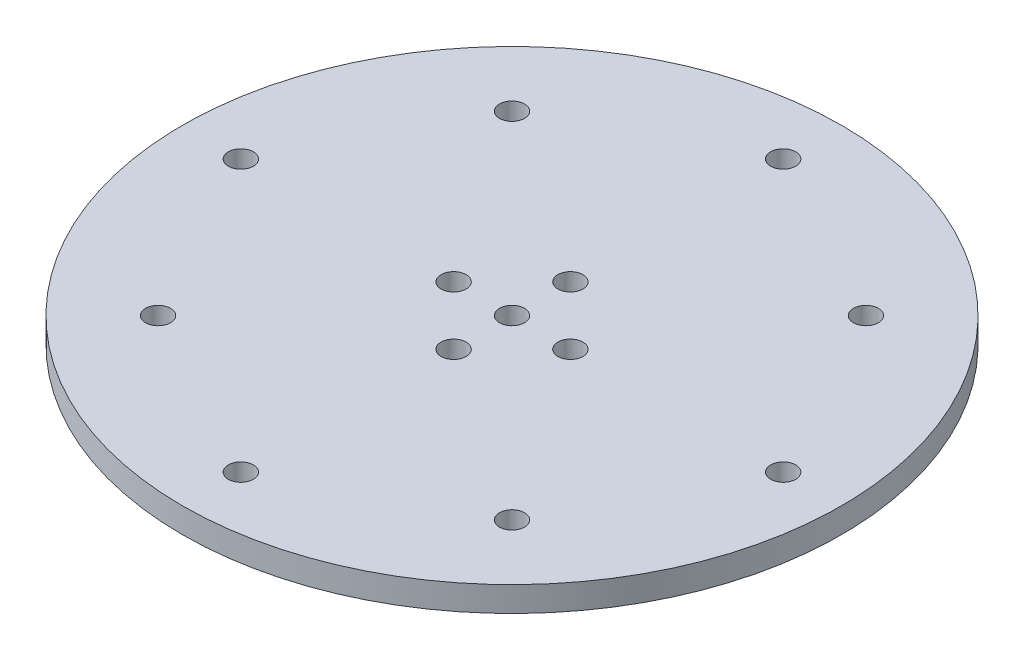
from build123d import *

# Parameters (mm, degrees)
SKETCH_1_R               = 39.5
SKETCH_1_R_2             = 1.5
EXTRUDE_1_DEPTH          = 3
CUT_EXTRUDE_1_DEPTH      = 56.941934182
CUT_EXTRUDE_1_DEPTH_BACK = 56.941934182
SKETCH_2_R               = 1.5


with BuildPart() as part:
    # 草图1 → 凸台-拉伸1 (new body)
    with BuildSketch(Plane(origin=(0, 0, 0), x_dir=(1, 0, 0), z_dir=(0, 1, 0))):
        with Locations(Location((0, 0, 0), (0, 0, 270))):
            Circle(SKETCH_1_R)
        with Locations(Location((0, 32.5, 0), (0, 0, 270))):
            Circle(SKETCH_1_R_2, mode=Mode.SUBTRACT)
        with Locations(Location((32.5, 0, 0), (0, 0, 270))):
            Circle(SKETCH_1_R_2, mode=Mode.SUBTRACT)
        with Locations(Location((0, -32.5, 0), (0, 0, 270))):
            Circle(SKETCH_1_R_2, mode=Mode.SUBTRACT)
        with Locations(Location((-32.5, 0, 0), (0, 0, 270))):
            Circle(SKETCH_1_R_2, mode=Mode.SUBTRACT)
        with Locations(Location((21.213203436, 21.213203436, 0), (0, 0, 270))):
            Circle(SKETCH_1_R_2, mode=Mode.SUBTRACT)
        with Locations(Location((21.213203436, -21.213203436, 0), (0, 0, 270))):
            Circle(SKETCH_1_R_2, mode=Mode.SUBTRACT)
        with Locations(Location((-21.213203436, -21.213203436, 0), (0, 0, 270))):
            Circle(SKETCH_1_R_2, mode=Mode.SUBTRACT)
        with Locations(Location((-21.213203436, 21.213203436, 0), (0, 0, 270))):
            Circle(SKETCH_1_R_2, mode=Mode.SUBTRACT)
    extrude(amount=EXTRUDE_1_DEPTH)

    # 草图2 → 切除-拉伸1 (cut, two sides: drawn at the far end of the back side and taken through both)
    with BuildSketch(Plane(origin=(0, 3, 0), x_dir=(1, 0, 0), z_dir=(0, 1, 0)).offset(-CUT_EXTRUDE_1_DEPTH_BACK)):
        with Locations(Location((0, 0, 0), (0, 0, 270))):
            Circle(SKETCH_2_R)
        with Locations(Location((0, 7, 0), (0, 0, 270))):
            Circle(SKETCH_2_R)
        with Locations(Location((7, 0, 0), (0, 0, 270))):
            Circle(SKETCH_2_R)
        with Locations(Location((0, -7, 0), (0, 0, 270))):
            Circle(SKETCH_2_R)
        with Locations(Location((-7, 0, 0), (0, 0, 270))):
            Circle(SKETCH_2_R)
    extrude(amount=CUT_EXTRUDE_1_DEPTH + CUT_EXTRUDE_1_DEPTH_BACK, mode=Mode.SUBTRACT)


solid = part.part
